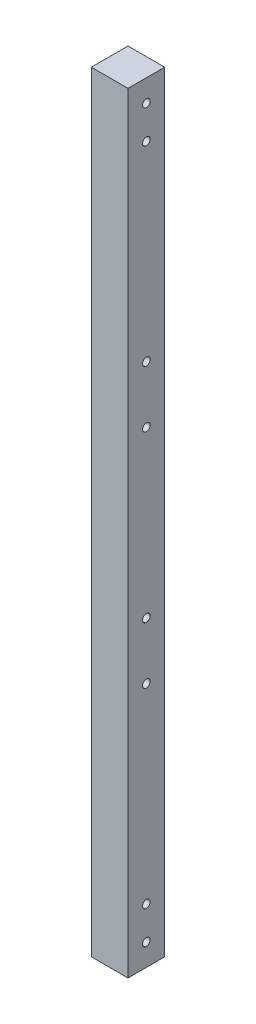
from build123d import *

# Parameters (mm, degrees)
SKETCH_1_W          = 20
SKETCH_1_H          = 20
EXTRUDE_1_DEPTH     = 420
SKETCH_3_R          = 2.1
CUT_EXTRUDE_2_DEPTH = 421.843322554
SKETCH_4_R          = 2.1
CUT_EXTRUDE_3_DEPTH = 421.843322554


with BuildPart() as part:
    # 草图1 → 凸台-拉伸1 (new body)
    with BuildSketch(Plane(origin=(0, 0, 0), x_dir=(1, 0, 0), z_dir=(0, 1, 0))):
        with Locations((-4.898373984, -7.581300813)):
            Rectangle(SKETCH_1_W, SKETCH_1_H)
    extrude(amount=EXTRUDE_1_DEPTH)

    # 草图3 → 切除-拉伸2 (cut, through all)
    with BuildSketch(Plane(origin=(5.101626016, 0, 0), x_dir=(0, 0, -1), z_dir=(1, 0, 0))):
        with Locations((-7.581300813, 390)):
            Circle(SKETCH_3_R)
        with Locations((-7.581300813, 408)):
            Circle(SKETCH_3_R)
        with Locations(Location((-7.581300813, 30, 0), (0, 0, 180))):
            Circle(SKETCH_3_R)
        with Locations(Location((-7.581300813, 12, 0), (0, 0, 180))):
            Circle(SKETCH_3_R)
    extrude(amount=-CUT_EXTRUDE_2_DEPTH, mode=Mode.SUBTRACT)

    # 草图4 → 切除-拉伸3 (cut, through all)
    with BuildSketch(Plane(origin=(5.101626016, 0, 0), x_dir=(0, 0, -1), z_dir=(1, 0, 0))):
        with Locations((-7.581300813, 255)):
            Circle(SKETCH_4_R)
        with Locations((-7.581300813, 286)):
            Circle(SKETCH_4_R)
        with Locations(Location((-7.581300813, 134, 0), (0, 0, 180))):
            Circle(SKETCH_4_R)
        with Locations(Location((-7.581300813, 165, 0), (0, 0, 180))):
            Circle(SKETCH_4_R)
    extrude(amount=-CUT_EXTRUDE_3_DEPTH, mode=Mode.SUBTRACT)


solid = part.part
